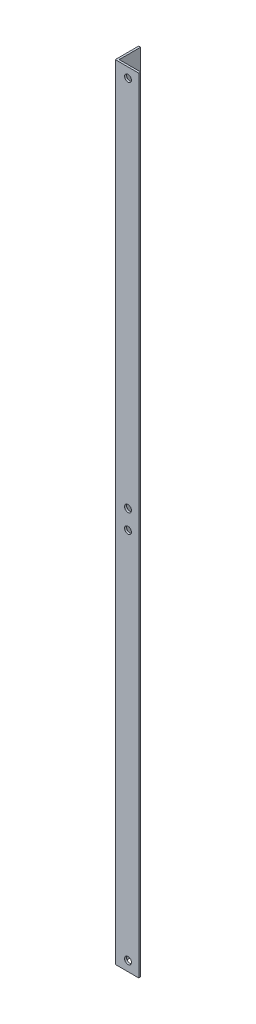
from build123d import *

# Parameters (mm, degrees)
BOSS_EXTRUDE1_DEPTH = 635
SKETCH19_R          = 5.588
CUT_EXTRUDE2_DEPTH  = 638.099965174


with BuildPart() as part:
    # Sketch18 → Boss-Extrude1 (new, symmetric)
    with BuildSketch(Plane(origin=(0, 0, 0), x_dir=(1, 0, 0), z_dir=(0, 1, 0))):
        Polygon((3.175, 38.1), (3.175, 3.175), (38.1, 3.175), (38.1, 0), (0, 0), (0, 38.1), align=None)
    extrude(amount=BOSS_EXTRUDE1_DEPTH, both=True)

    # Sketch19 → Cut-Extrude2 (cut, through all)
    with BuildSketch(Plane(origin=(0, 0, -3.175), x_dir=(-1, 0, 0), z_dir=(0, 0, -1))):
        with Locations((-20.6375, 619.125)):
            Circle(SKETCH19_R)
        with Locations((-20.6375, 15.24)):
            Circle(SKETCH19_R)
    cut_extrude2 = extrude(amount=-CUT_EXTRUDE2_DEPTH, mode=Mode.SUBTRACT)

    # Mirror2: Cut-Extrude2 across plane
    add(cut_extrude2.mirror(Plane.ZX), mode=Mode.SUBTRACT)


solid = part.part
